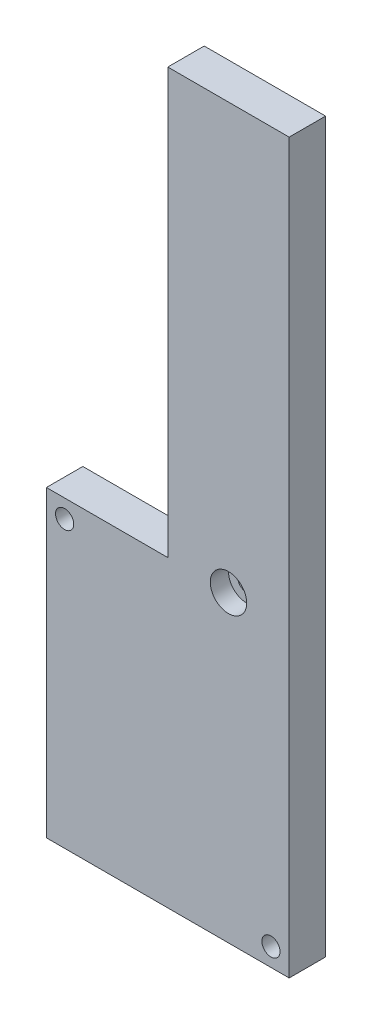
from build123d import *

# Parameters (mm, degrees)
ESQUISSE1_W             = 40
ESQUISSE1_H             = 120
BOSS_EXTRU_1_DEPTH      = 6
ESQUISSE2_W             = 20
ESQUISSE2_H             = 70
ENL_V_MAT_EXTRU_1_DEPTH = 6
ESQUISSE4_R             = 1.5
ENL_V_MAT_EXTRU_2_DEPTH = 6
ESQUISSE5_R             = 3
ENL_V_MAT_EXTRU_3_DEPTH = 3


with BuildPart() as part:
    # Esquisse1 → Boss.-Extru.1 (new body)
    with BuildSketch(Plane.XY):
        with Locations((20, 60)):
            Rectangle(ESQUISSE1_W, ESQUISSE1_H)
    extrude(amount=BOSS_EXTRU_1_DEPTH)

    # Esquisse2 → Enlèv. mat.-Extru.1 (cut)
    with BuildSketch(Plane.XY.offset(6)):
        with Locations((10, 85)):
            Rectangle(ESQUISSE2_W, ESQUISSE2_H)
    extrude(amount=-ENL_V_MAT_EXTRU_1_DEPTH, mode=Mode.SUBTRACT)

    # Esquisse4 → Enlèv. mat.-Extru.2 (cut)
    with BuildSketch(Plane.XY.offset(6)):
        with Locations((3, 47)):
            Circle(ESQUISSE4_R)
        with Locations((37, 3)):
            Circle(ESQUISSE4_R)
        with Locations((30, 50)):
            Circle(ESQUISSE4_R)
    extrude(amount=-ENL_V_MAT_EXTRU_2_DEPTH, mode=Mode.SUBTRACT)

    # Esquisse5 → Enlèv. mat.-Extru.3 (cut)
    with BuildSketch(Plane.XY.offset(6)):
        with Locations((30, 50)):
            Circle(ESQUISSE5_R)
    extrude(amount=-ENL_V_MAT_EXTRU_3_DEPTH, mode=Mode.SUBTRACT)


solid = part.part
